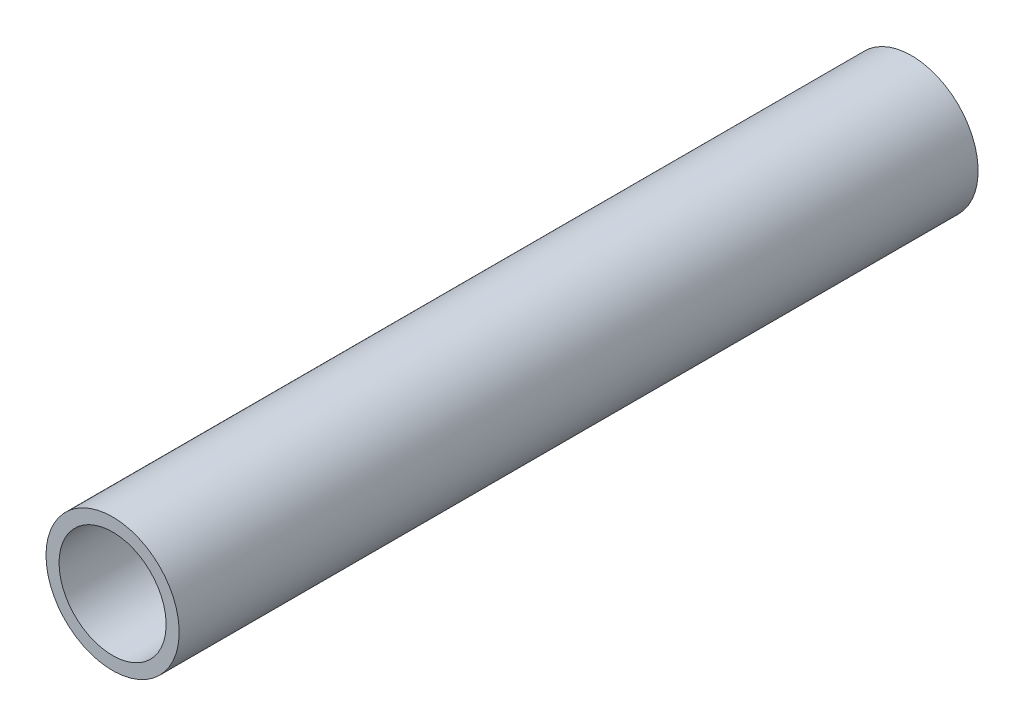
from build123d import *

# Parameters (mm, degrees)
SKETCH2_R           = 6.35
SKETCH2_R_2         = 5.1054
BOSS_EXTRUDE1_DEPTH = 76.2


with BuildPart() as part:
    # Sketch2 → Boss-Extrude1 (new body)
    with BuildSketch(Plane.XY):
        with Locations(Location((0, 0, 0), (0, 0, 180))):
            Circle(SKETCH2_R)
        with Locations(Location((0, 0, 0), (0, 0, 180))):
            Circle(SKETCH2_R_2, mode=Mode.SUBTRACT)
    extrude(amount=BOSS_EXTRUDE1_DEPTH)


solid = part.part
